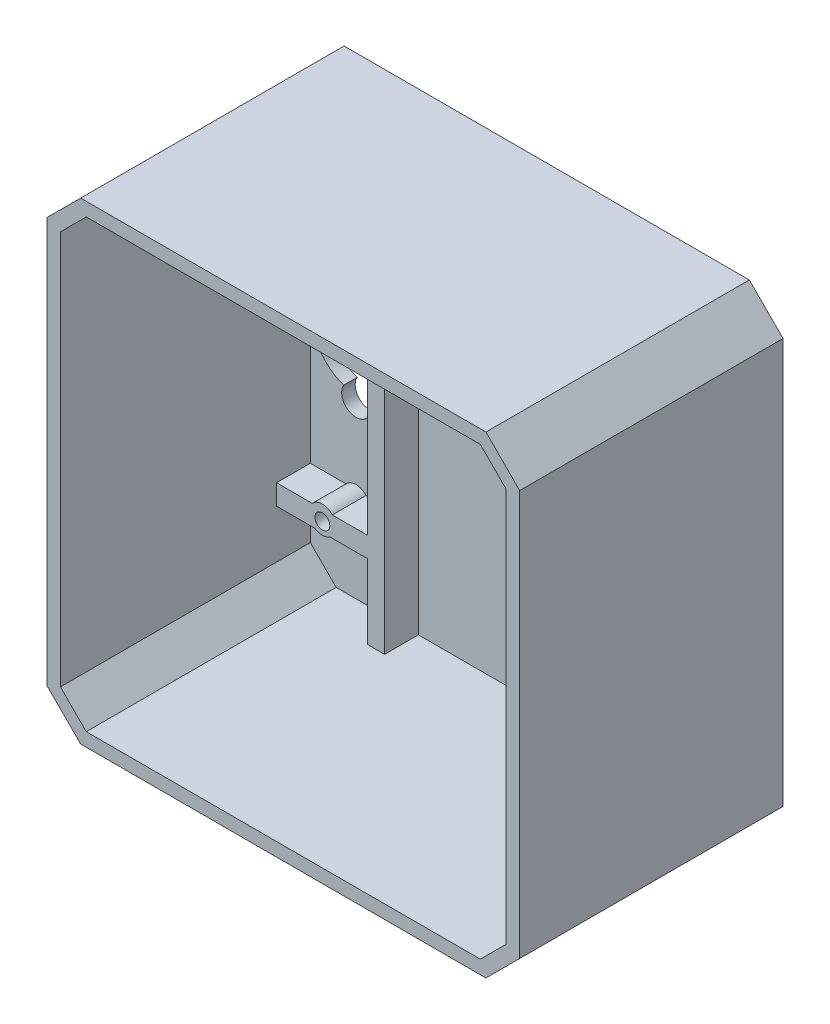
from build123d import *

# Parameters (mm, degrees)
SKETCH1_W           = 70
SKETCH1_H           = 70
BOSS_EXTRUDE1_DEPTH = 39
CHAMFER1_SIZE       = 5
SHELL1_T            = -2
SKETCH3_W           = 2.5
SKETCH3_H           = 66
BOSS_EXTRUDE2_DEPTH = 5
SKETCH4_W           = 13.5
SKETCH4_H           = 3
BOSS_EXTRUDE3_DEPTH = 5
SKETCH5_W           = 13.5
SKETCH5_H           = 5.5
CUT_EXTRUDE1_DEPTH  = 133.059792404
SKETCH6_R           = 6.25
CUT_EXTRUDE2_DEPTH  = 133.059792404
CUT_EXTRUDE3_DEPTH  = 10
SKETCH9_R           = 2
BOSS_EXTRUDE4_DEPTH = 5
SKETCH10_R          = 1.1
CUT_EXTRUDE4_DEPTH  = 4


with BuildPart() as part:
    # Sketch1 → Boss-Extrude1 (new body)
    with BuildSketch(Plane.XY):
        with Locations((86.822194683, -0.073375262)):
            Rectangle(SKETCH1_W, SKETCH1_H)
    extrude(amount=-BOSS_EXTRUDE1_DEPTH)

    # Chamfer1
    chamfer1_edges = [part.edges().sort_by_distance(p)[0] for p in [
        (51.822194683, 34.926624738, -19.5),
        (121.822194683, 34.926624738, -19.5),
        (121.822194683, -35.073375262, -19.5),
        (51.822194683, -35.073375262, -19.5),
    ]]
    chamfer(chamfer1_edges, length=CHAMFER1_SIZE)

    # Shell1
    shell1_openings = [part.faces().sort_by_distance(p)[0] for p in [
        (86.822194683, -0.073375262, 0),
    ]]
    offset(amount=SHELL1_T, openings=shell1_openings, kind=Kind.INTERSECTION)

    # Sketch3 → Boss-Extrude2 (add)
    with BuildSketch(Plane.XY.offset(-37)):
        with Locations((68.572194683, -0.073375262)):
            Rectangle(SKETCH3_W, SKETCH3_H)
        with Locations((105.072194683, -0.073375262)):
            Rectangle(SKETCH3_W, SKETCH3_H)
    extrude(amount=BOSS_EXTRUDE2_DEPTH)

    # Sketch4 → Boss-Extrude3 (add)
    with BuildSketch(Plane.XY.offset(-37)):
        with Locations((60.572194683, -20.573375262)):
            Rectangle(SKETCH4_W, SKETCH4_H)
        with Locations((60.572194683, 8.426624738)):
            Rectangle(SKETCH4_W, SKETCH4_H)
        with Locations((113.072194683, -20.573375262)):
            Rectangle(SKETCH4_W, SKETCH4_H)
        with Locations((113.072194683, 8.426624738)):
            Rectangle(SKETCH4_W, SKETCH4_H)
    extrude(amount=BOSS_EXTRUDE3_DEPTH)

    # Sketch5 → Cut-Extrude1 (cut, through all)
    with BuildSketch(Plane.XY.offset(-37)):
        with Locations((60.572194683, 12.676624738)):
            Rectangle(SKETCH5_W, SKETCH5_H)
        with Locations((113.072194683, 12.676624738)):
            Rectangle(SKETCH5_W, SKETCH5_H)
    extrude(amount=-CUT_EXTRUDE1_DEPTH, mode=Mode.SUBTRACT)

    # Sketch6 → Cut-Extrude2 (cut, through all)
    with BuildSketch(Plane.XY.offset(-37)):
        with Locations((60.586585442, -0.573375262)):
            Circle(SKETCH6_R)
        with Locations(Location((113.057803924, -0.573375262, 0), (0, 0, 180))):
            Circle(SKETCH6_R)
    extrude(amount=-CUT_EXTRUDE2_DEPTH, mode=Mode.SUBTRACT)

    # Sketch8 → Cut-Extrude3 (cut)
    with BuildSketch(Plane.XY.offset(-37)):
        with BuildLine():
            Line((58.792309456, -6.560283787), (62.384377825, -6.559228798))
            ThreePointArc((62.384377825, -6.559228798), (60.589297041, -9.805930725), (58.792309456, -6.560283787))
        make_face()
        with BuildLine():
            Line((114.85207991, -6.560283787), (111.260011542, -6.559228798))
            ThreePointArc((111.260011542, -6.559228798), (113.055092325, -9.805930725), (114.85207991, -6.560283787))
        make_face()
    extrude(amount=-CUT_EXTRUDE3_DEPTH, mode=Mode.SUBTRACT)

    # Sketch9 → Boss-Extrude4 (add)
    with BuildSketch(Plane.XY.offset(-32)):
        with Locations((60.59354187, 8.400826661)):
            Circle(SKETCH9_R)
        with Locations((60.59354187, -20.414986166)):
            Circle(SKETCH9_R)
        with Locations((113.050847497, -20.414986166)):
            Circle(SKETCH9_R)
        with Locations((113.050847497, 8.400826661)):
            Circle(SKETCH9_R)
    extrude(amount=-BOSS_EXTRUDE4_DEPTH)

    # Sketch10 → Cut-Extrude4 (cut)
    with BuildSketch(Plane.XY.offset(-32)):
        with Locations((60.60651545, 8.30988812)):
            Circle(SKETCH10_R)
        with Locations((60.60651545, -20.632962205)):
            Circle(SKETCH10_R)
        with Locations(Location((113.037873916, -20.632962205, 0), (0, 0, 180))):
            Circle(SKETCH10_R)
        with Locations(Location((113.037873916, 8.30988812, 0), (0, 0, 180))):
            Circle(SKETCH10_R)
    extrude(amount=-CUT_EXTRUDE4_DEPTH, mode=Mode.SUBTRACT)


solid = part.part
